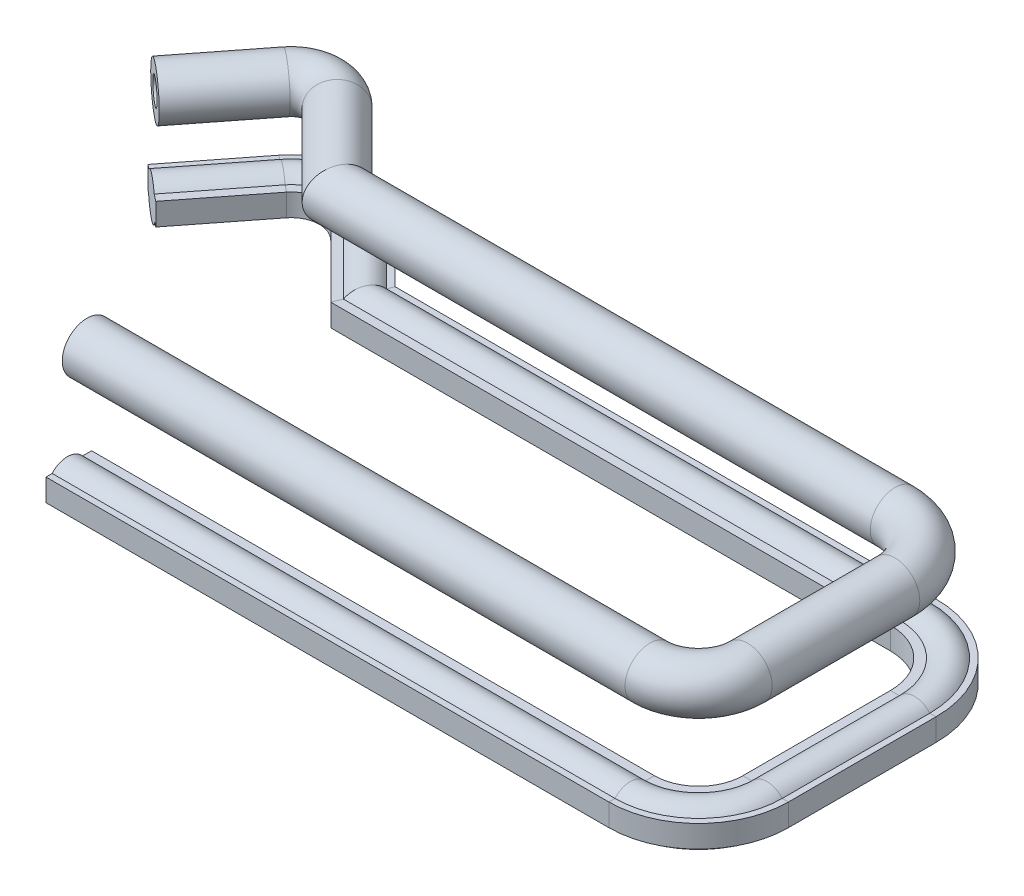
from build123d import *

# Parameters (mm, degrees)
CIRCLE_OUT_PATH_R   = 9.96301755
CIRCLE_OUT_PATH_R_2 = 4.96301755


with BuildPart() as part:
    # Sweep1: sweep along a path in Path
    with BuildLine(Plane(origin=(0, 0, 0), x_dir=(1, 0, 0), z_dir=(0, 1, 0))) as sweep1_path:
        Line((-106.184369929, -59.042693327), (120.118583283, -59.042693327))
        ThreePointArc((120.118583283, -59.042693327), (138.927485513, -51.25179093), (146.71838791, -32.4428887))
        Line((146.71838791, -32.4428887), (146.71838791, 26.895137006))
        ThreePointArc((146.71838791, 26.895137006), (137.489165071, 49.176451956), (115.207850121, 58.405674795))
        Line((115.207850121, 58.405674795), (-106.184369929, 58.405674795))
        Line((-106.184369929, 58.405674795), (-134.070607025, 86.291911892))
        ThreePointArc((-134.070607025, 86.291911892), (-149.427024925, 92.112880199), (-163.964703156, 84.473563843))
        Line((-163.964703156, 84.473563843), (-187.062271503, 54.950823192))
    # profile circle → Sweep1 (sweep)
    with BuildSketch(Plane(origin=(0, 0, 0), x_dir=(0, 0, -1), z_dir=(1, 0, 0))):
        with BuildLine():
            Line((-68.550037376, 5.2750248), (-66.063209392, 5.2750248))
            ThreePointArc((-66.063209392, 5.2750248), (-59.951867352, 8.0730656), (-53.840525311, 5.2750248))
            Line((-53.840525311, 5.2750248), (-50.231709436, 5.2750248))
            Line((-50.231709436, 5.2750248), (-50.231709436, -3.679301637))
            Line((-50.231709436, -3.679301637), (-52.765969521, -3.679301637))
            ThreePointArc((-52.765969521, -3.679301637), (-59.951867352, -8.0730656), (-67.137765183, -3.679301637))
            Line((-67.137765183, -3.679301637), (-68.550037376, -3.679301637))
            Line((-68.550037376, -3.679301637), (-68.550037376, 5.2750248))
        make_face()
    sweep(path=sweep1_path.line, transition=Transition.RIGHT)


with BuildPart() as body_2:
    # Sweep-Thin1: sweep along a path in Path<2>
    with BuildLine(Plane(origin=(0, 0, 0), x_dir=(1, 0, 0), z_dir=(0, 1, 0))) as sweep_thin1_path:
        Line((-106.184369929, -59.042693327), (120.118583283, -59.042693327))
        ThreePointArc((120.118583283, -59.042693327), (138.927485513, -51.25179093), (146.71838791, -32.4428887))
        Line((146.71838791, -32.4428887), (146.71838791, 26.895137006))
        ThreePointArc((146.71838791, 26.895137006), (137.489165071, 49.176451956), (115.207850121, 58.405674795))
        Line((115.207850121, 58.405674795), (-106.184369929, 58.405674795))
        Line((-106.184369929, 58.405674795), (-134.070607025, 86.291911892))
        ThreePointArc((-134.070607025, 86.291911892), (-149.427024925, 92.112880199), (-163.964703156, 84.473563843))
        Line((-163.964703156, 84.473563843), (-187.062271503, 54.950823192))
    # circle out path → Sweep-Thin1 (sweep)
    with BuildSketch(Plane(origin=(0, 0, 0), x_dir=(0, 0, -1), z_dir=(1, 0, 0))):
        with Locations((-52.063927017, 42.400056729)):
            Circle(CIRCLE_OUT_PATH_R)
        with Locations((-52.063927017, 42.400056729)):
            Circle(CIRCLE_OUT_PATH_R_2, mode=Mode.SUBTRACT)
    sweep(path=sweep_thin1_path.line, transition=Transition.RIGHT)


solid = Compound([part.part, body_2.part])
